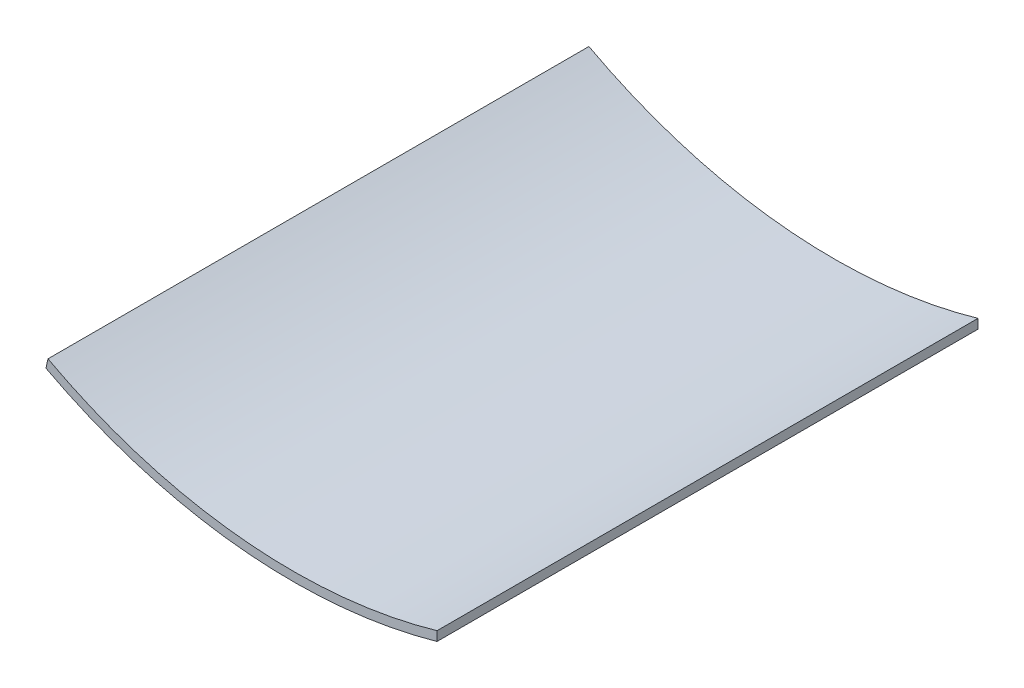
from build123d import *

# Parameters (mm, degrees)
BOSS_EXTRUDE1_DEPTH = 190.5


with BuildPart() as part:
    # Sketch1 → Boss-Extrude1 (new body)
    with BuildSketch(Plane(origin=(0, 0, 0), x_dir=(0, 1, 0), z_dir=(0, 0, 1))):
        with BuildLine():
            Line((-164.512361246, 86.903084078), (-161.2818182, 86.216410956))
            ThreePointArc((-161.2818182, 86.216410956), (-181.878164225, 19.116165362), (-175.682823292, -50.8))
            Line((-175.682823292, -50.8), (-178.985538592, -50.8))
            ThreePointArc((-178.985538592, -50.8), (-185.035771243, 19.448043233), (-164.512361246, 86.903084078))
        make_face()
    extrude(amount=BOSS_EXTRUDE1_DEPTH)


solid = part.part
